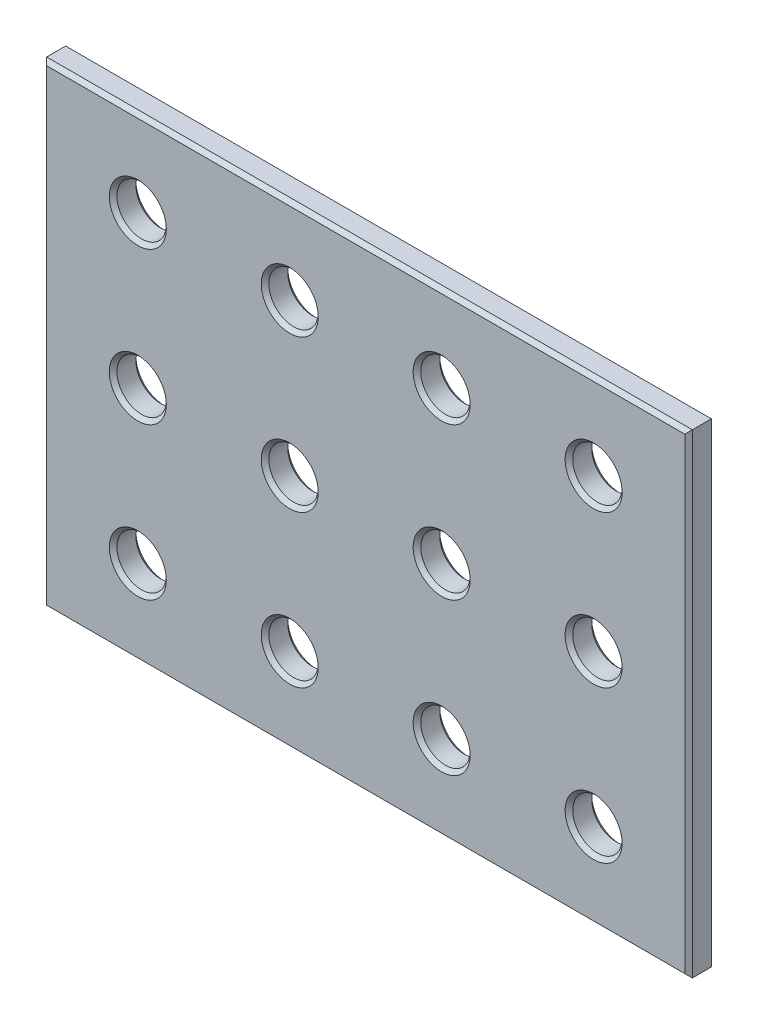
from build123d import *

# Parameters (mm, degrees)
SKETCH_1_W        = 340
SKETCH_1_H        = 250
SKETCH_1_R        = 13
EXTRUDE_411_DEPTH = 14
CHAMFER_1_SIZE    = 2


with BuildPart() as part:
    # 草图1 → Extrude 411 (new body)
    with BuildSketch(Plane.XY):
        Rectangle(SKETCH_1_W, SKETCH_1_H)
        with Locations((-120, 80)):
            Circle(SKETCH_1_R, mode=Mode.SUBTRACT)
        with Locations((-40, 80)):
            Circle(SKETCH_1_R, mode=Mode.SUBTRACT)
        with Locations((-40, 0)):
            Circle(SKETCH_1_R, mode=Mode.SUBTRACT)
        with Locations((-120, 0)):
            Circle(SKETCH_1_R, mode=Mode.SUBTRACT)
        with Locations(Location((-40, -80, 0), (0, 0, 180))):
            Circle(SKETCH_1_R, mode=Mode.SUBTRACT)
        with Locations(Location((-120, -80, 0), (0, 0, 180))):
            Circle(SKETCH_1_R, mode=Mode.SUBTRACT)
        with Locations((120, -80)):
            Circle(SKETCH_1_R, mode=Mode.SUBTRACT)
        with Locations((40, -80)):
            Circle(SKETCH_1_R, mode=Mode.SUBTRACT)
        with Locations(Location((120, 0, 0), (0, 0, 180))):
            Circle(SKETCH_1_R, mode=Mode.SUBTRACT)
        with Locations(Location((40, 0, 0), (0, 0, 180))):
            Circle(SKETCH_1_R, mode=Mode.SUBTRACT)
        with Locations(Location((40, 80, 0), (0, 0, 180))):
            Circle(SKETCH_1_R, mode=Mode.SUBTRACT)
        with Locations(Location((120, 80, 0), (0, 0, 180))):
            Circle(SKETCH_1_R, mode=Mode.SUBTRACT)
    extrude(amount=EXTRUDE_411_DEPTH)

    # 倒角1
    chamfer_1_edges = [part.edges().sort_by_distance(p)[0] for p in [
        (170, 0, 14),
        (-133, 80, 0),
        (-133, 80, 14),
        (0, 125, 14),
        (-53, 80, 0),
        (-53, 80, 14),
        (-53, 0, 0),
        (-53, 0, 14),
        (-133, 0, 0),
        (-133, 0, 14),
        (-27, -80, 0),
        (-27, -80, 14),
        (-107, -80, 0),
        (-107, -80, 14),
        (107, -80, 0),
        (107, -80, 14),
        (27, -80, 0),
        (27, -80, 14),
        (-170, 0, 14),
        (133, 0, 0),
        (133, 0, 14),
        (0, 125, 0),
        (53, 0, 0),
        (53, 0, 14),
        (170, 0, 0),
        (53, 80, 0),
        (53, 80, 14),
        (0, -125, 0),
        (133, 80, 0),
        (133, 80, 14),
        (-170, 0, 0),
        (0, -125, 14),
    ]]
    chamfer(chamfer_1_edges, length=CHAMFER_1_SIZE)


solid = part.part
